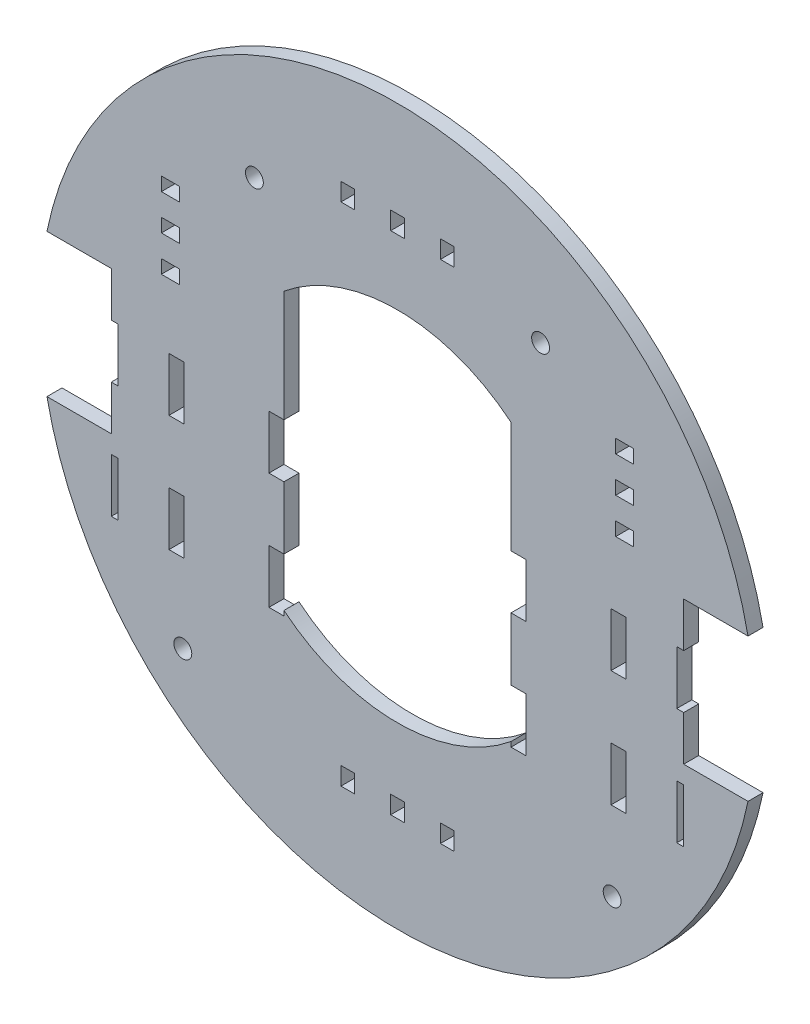
from build123d import *

# Parameters (mm, degrees)
SKETCH1_R           = 127
SKETCH1_R_2         = 63.5
BOSS_EXTRUDE1_DEPTH = 5.334
SKETCH2_W           = 50.8
SKETCH2_H           = 50.8
WHEELSCUT_DEPTH     = 180.684310823
SKETCH3_W           = 4.826
SKETCH3_H           = 6.35
TOPBOTTOMCUT_DEPTH  = 178.879992006
SKETCH4_W           = 6.35
SKETCH4_H           = 4.826
SIDECUT_DEPTH       = 178.879992006
SKETCH14_R          = 3.175
BOLTHOLES_DEPTH     = 178.879992006
SKETCH15_W          = 2.4638
SKETCH15_H          = 19.05
SKETCH15_W_2        = 5.334
MOTORMOUNTS_DEPTH   = 178.879992006


with BuildPart() as part:
    # Sketch1 → Boss-Extrude1 (new body)
    # profile 1 of 3: a face of its own
    with BuildSketch(Plane.XY):
        Circle(SKETCH1_R)
        Circle(SKETCH1_R_2, mode=Mode.SUBTRACT)
    # profile 2 of 3: a face of its own
    with BuildSketch(Plane.XY):
        with BuildLine():
            Line((-40.299999918, -49.073006904), (-40.299999918, 49.073006904))
            ThreePointArc((-40.299999918, 49.073006904), (-63.5, 0), (-40.299999918, -49.073006904))
        make_face()
    # profile 3 of 3: a face of its own
    with BuildSketch(Plane.XY):
        with BuildLine():
            ThreePointArc((63.5, 0), (57.407752067, 27.140375874), (40.299999918, 49.073006904))
            Line((40.299999918, 49.073006904), (40.299999918, -49.073006904))
            ThreePointArc((40.299999918, -49.073006904), (57.407752067, -27.140375874), (63.5, 0))
        make_face()
    extrude(amount=BOSS_EXTRUDE1_DEPTH)

    # Sketch2 → WheelsCut (cut, through all)
    with BuildSketch(Plane.XY.offset(5.334)):
        with Locations((-127, 0)):
            Rectangle(SKETCH2_W, SKETCH2_H)
        with Locations((127, 0)):
            Rectangle(SKETCH2_W, SKETCH2_H)
    extrude(amount=-WHEELSCUT_DEPTH, mode=Mode.SUBTRACT)

    # Sketch3 → TopBottomCut (cut, through all)
    with BuildSketch(Plane.XY.offset(5.334)):
        with Locations((-17.653, 89.789)):
            Rectangle(SKETCH3_W, SKETCH3_H)
        with Locations((17.653, 89.789)):
            Rectangle(SKETCH3_W, SKETCH3_H)
        with Locations((0, -89.789)):
            Rectangle(SKETCH3_W, SKETCH3_H)
        with Locations((0, 89.789)):
            Rectangle(SKETCH3_W, SKETCH3_H)
        with Locations((17.653, -89.789)):
            Rectangle(SKETCH3_W, SKETCH3_H)
        with Locations((-17.653, -89.789)):
            Rectangle(SKETCH3_W, SKETCH3_H)
    extrude(amount=-TOPBOTTOMCUT_DEPTH, mode=Mode.SUBTRACT)

    # Sketch4 → SideCut (cut, through all)
    with BuildSketch(Plane.XY.offset(5.334)):
        with Locations((-80.645, 47.625)):
            Rectangle(SKETCH4_W, SKETCH4_H)
        with Locations((-80.645, 34.925)):
            Rectangle(SKETCH4_W, SKETCH4_H)
        with Locations((-80.645, 60.325)):
            Rectangle(SKETCH4_W, SKETCH4_H)
        with Locations((80.645, 60.325)):
            Rectangle(SKETCH4_W, SKETCH4_H)
        with Locations((80.645, 47.625)):
            Rectangle(SKETCH4_W, SKETCH4_H)
        with Locations((80.645, 34.925)):
            Rectangle(SKETCH4_W, SKETCH4_H)
    extrude(amount=-SIDECUT_DEPTH, mode=Mode.SUBTRACT)

    # Sketch14 → BoltHoles (cut, through all)
    with BuildSketch(Plane.XY.offset(5.334)):
        with Locations((-76.2, -78.74)):
            Circle(SKETCH14_R)
        with Locations((-50.8, 78.74)):
            Circle(SKETCH14_R)
        with Locations(Location((76.2, -78.74, 0), (0, 0, 180))):
            Circle(SKETCH14_R)
        with Locations(Location((50.8, 78.74, 0), (0, 0, 180))):
            Circle(SKETCH14_R)
    extrude(amount=-BOLTHOLES_DEPTH, mode=Mode.SUBTRACT)

    # Sketch15 → MotorMounts (cut, through all)
    with BuildSketch(Plane.XY.offset(5.334)):
        with Locations((-100.3681, -41.275)):
            Rectangle(SKETCH15_W, SKETCH15_H)
        with Locations((-100.3681, 0)):
            Rectangle(SKETCH15_W, SKETCH15_H)
        with Locations((-78.469199932, 0)):
            Rectangle(SKETCH15_W_2, SKETCH15_H)
        with Locations((-42.966999918, 0)):
            Rectangle(SKETCH15_W_2, SKETCH15_H)
        with Locations((-78.469199932, -41.275)):
            Rectangle(SKETCH15_W_2, SKETCH15_H)
        with Locations((-42.966999918, -41.275)):
            Rectangle(SKETCH15_W_2, SKETCH15_H)
        with Locations((42.966999918, -41.275)):
            Rectangle(SKETCH15_W_2, SKETCH15_H)
        with Locations((78.469199932, -41.275)):
            Rectangle(SKETCH15_W_2, SKETCH15_H)
        with Locations((100.3681, -41.275)):
            Rectangle(SKETCH15_W, SKETCH15_H)
        with Locations((42.966999918, 0)):
            Rectangle(SKETCH15_W_2, SKETCH15_H)
        with Locations((78.469199932, 0)):
            Rectangle(SKETCH15_W_2, SKETCH15_H)
        with Locations((100.3681, 0)):
            Rectangle(SKETCH15_W, SKETCH15_H)
    extrude(amount=-MOTORMOUNTS_DEPTH, mode=Mode.SUBTRACT)


solid = part.part
